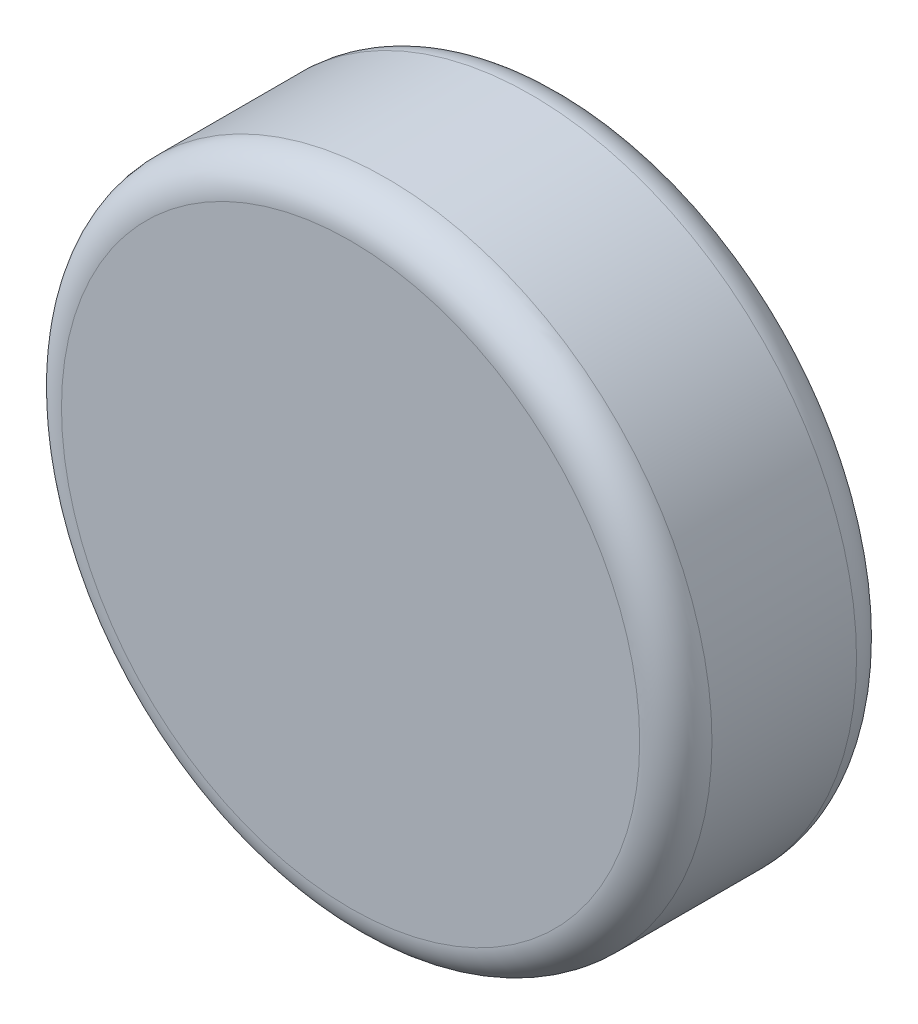
from build123d import *

# Parameters (mm, degrees)
SKETCH1_R           = 45
BOSS_EXTRUDE1_DEPTH = 30
FILLET1_R           = 5


with BuildPart() as part:
    # Sketch1 → Boss-Extrude1 (new body)
    with BuildSketch(Plane.XY):
        with Locations((89.493699938, -41.882987358)):
            Circle(SKETCH1_R)
    extrude(amount=BOSS_EXTRUDE1_DEPTH)

    # Fillet1
    fillet1_edges = [part.edges().sort_by_distance(p)[0] for p in [
        (44.493699938, -41.882987358, 0),
        (44.493699938, -41.882987358, 30),
    ]]
    fillet(fillet1_edges, radius=FILLET1_R)


solid = part.part
